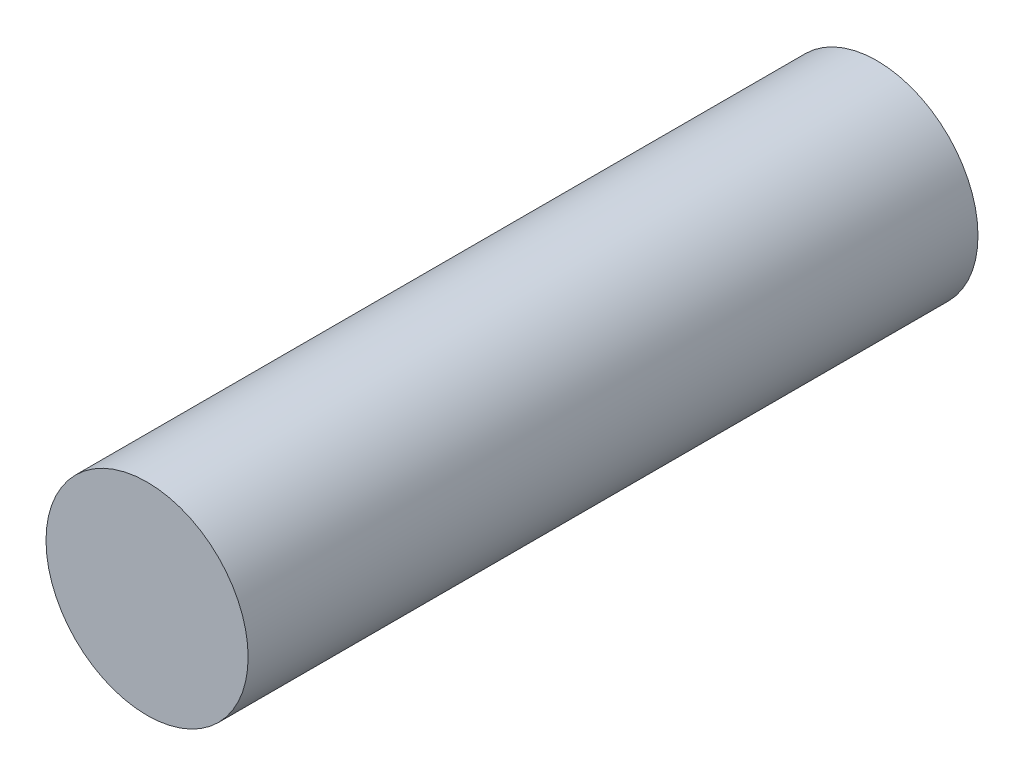
from build123d import *

# Parameters (mm, degrees)
SKETCH3_R           = 9
BOSS_EXTRUDE4_DEPTH = 65
SKETCH4_R           = 3
BOSS_EXTRUDE5_DEPTH = 1.5


with BuildPart() as part:
    # Sketch3 → Boss-Extrude4 (new body)
    with BuildSketch(Plane.XY):
        with Locations((-43.226718076, 0)):
            Circle(SKETCH3_R)
    extrude(amount=BOSS_EXTRUDE4_DEPTH)

    # Sketch4 → Boss-Extrude5 (add)
    with BuildSketch(Plane.XY):
        with Locations((-43.226718076, 0)):
            Circle(SKETCH4_R)
    extrude(amount=-BOSS_EXTRUDE5_DEPTH)


solid = part.part
